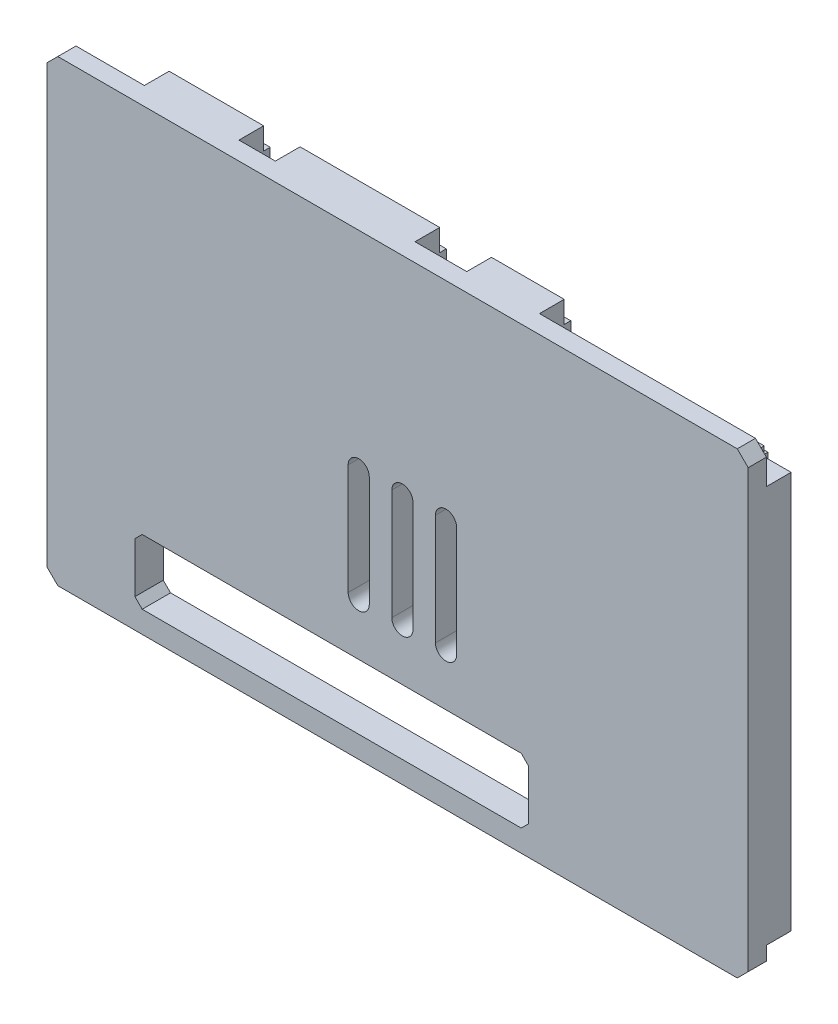
from build123d import *

# Parameters (mm, degrees)
SKETCH1_W            = 96.4
SKETCH1_H            = 63
BOSS_EXTRUDE1_DEPTH  = 2.5
SKETCH1_5_W          = 93
SKETCH1_5_H          = 59.6
BOSS_EXTRUDE2_DEPTH  = 1.4
CHAMFER1_SIZE        = 1.5
SKETCH3_W            = 1.7
SKETCH3_H            = 13.2
BOSS_EXTRUDE4_DEPTH  = 1.7
SKETCH4_W            = 13
SKETCH4_H            = 1.7
SKETCH4_W_2          = 10
SKETCH4_W_3          = 19.2
BOSS_EXTRUDE5_DEPTH  = 1.6
SKETCH4_3_W          = 13
SKETCH4_3_H          = 3
SKETCH4_3_W_2        = 10
SKETCH4_3_W_3        = 19.2
BOSS_EXTRUDE6_DEPTH  = 2
SKETCH3_5_W          = 3
SKETCH3_5_H          = 13.2
BOSS_EXTRUDE7_DEPTH  = 1
SKETCH5_W            = 1.7
SKETCH5_H            = 54.6
BOSS_EXTRUDE8_DEPTH  = 1.6
SKETCH5_3_W          = 3
SKETCH5_3_H          = 54.6
BOSS_EXTRUDE9_DEPTH  = 2
SKETCH7_W            = 54.1
SKETCH7_H            = 8.9
CUT_EXTRUDE2_DEPTH   = 12
CHAMFER2_SIZE        = 1
SKETCH11_W           = 10
SKETCH11_H           = 2
SKETCH11_W_2         = 19.2
SKETCH11_W_3         = 13
BOSS_EXTRUDE10_DEPTH = 2
SKETCH13_W           = 10
SKETCH13_H           = 2
SKETCH13_W_2         = 19.2
SKETCH13_W_3         = 13
BOSS_EXTRUDE12_DEPTH = 0.9
SKETCH14_W           = 54.1
SKETCH14_H           = 3
BOSS_EXTRUDE13_DEPTH = 2.9
SKETCH15_W           = 2
SKETCH15_H           = 54.6
BOSS_EXTRUDE14_DEPTH = 4.5
SKETCH16_W           = 3.5
SKETCH16_H           = 54.6
BOSS_EXTRUDE15_DEPTH = 0.8
CUT_EXTRUDE3_DEPTH   = 10


with BuildPart() as part:
    # Sketch1 → Boss-Extrude1 (new body)
    with BuildSketch(Plane.XY):
        with Locations((10.058192988, -1.431154761)):
            Rectangle(SKETCH1_W, SKETCH1_H)
    extrude(amount=BOSS_EXTRUDE1_DEPTH)

    # Sketch1<5> → Boss-Extrude2 (add)
    with BuildSketch(Plane.XY):
        with Locations((10.058192988, -1.431154761)):
            Rectangle(SKETCH1_5_W, SKETCH1_5_H)
    extrude(amount=-BOSS_EXTRUDE2_DEPTH)

    # Chamfer1
    chamfer1_edges = [part.edges().sort_by_distance(p)[0] for p in [
        (58.258192988, 30.068845239, 1.25),
        (-38.141807012, 30.068845239, 1.25),
        (-38.141807012, -32.931154761, 1.25),
        (58.258192988, -32.931154761, 1.25),
    ]]
    chamfer(chamfer1_edges, length=CHAMFER1_SIZE)

    # Sketch3 → Boss-Extrude4 (add)
    with BuildSketch(Plane(origin=(0, 0, -1.4), x_dir=(-1, 0, 0), z_dir=(0, 0, -1))):
        with Locations((37.291807012, -1.631154761)):
            Rectangle(SKETCH3_W, SKETCH3_H)
    extrude(amount=-BOSS_EXTRUDE4_DEPTH)

    # Sketch4 → Boss-Extrude5 (add)
    with BuildSketch(Plane(origin=(0, 0, -1.4), x_dir=(-1, 0, 0), z_dir=(0, 0, -1))):
        with Locations((20.741807012, 29.218845239)):
            Rectangle(SKETCH4_W, SKETCH4_H)
        with Locations((-22.068192988, 29.218845239)):
            Rectangle(SKETCH4_W_2, SKETCH4_H)
        with Locations((-0.358192988, 29.218845239)):
            Rectangle(SKETCH4_W_3, SKETCH4_H)
    extrude(amount=-BOSS_EXTRUDE5_DEPTH)

    # Sketch4<3> → Boss-Extrude6 (add)
    with BuildSketch(Plane(origin=(0, 0, -1.4), x_dir=(-1, 0, 0), z_dir=(0, 0, -1))):
        with Locations((20.741807012, 28.568845239)):
            Rectangle(SKETCH4_3_W, SKETCH4_3_H)
        with Locations((-22.068192988, 28.568845239)):
            Rectangle(SKETCH4_3_W_2, SKETCH4_3_H)
        with Locations((-0.358192988, 28.568845239)):
            Rectangle(SKETCH4_3_W_3, SKETCH4_3_H)
    extrude(amount=BOSS_EXTRUDE6_DEPTH)

    # Sketch3<5> → Boss-Extrude7 (add)
    with BuildSketch(Plane(origin=(0, 0, -1.4), x_dir=(-1, 0, 0), z_dir=(0, 0, -1))):
        with Locations((36.641807012, -1.631154761)):
            Rectangle(SKETCH3_5_W, SKETCH3_5_H)
    extrude(amount=BOSS_EXTRUDE7_DEPTH)

    # Sketch5 → Boss-Extrude8 (add)
    with BuildSketch(Plane(origin=(0, 0, -1.4), x_dir=(-1, 0, 0), z_dir=(0, 0, -1))):
        with Locations((-57.408192988, -2.231154761)):
            Rectangle(SKETCH5_W, SKETCH5_H)
    extrude(amount=-BOSS_EXTRUDE8_DEPTH)

    # Sketch5<3> → Boss-Extrude9 (add)
    with BuildSketch(Plane(origin=(0, 0, -1.4), x_dir=(-1, 0, 0), z_dir=(0, 0, -1))):
        with Locations((-56.758192988, -2.231154761)):
            Rectangle(SKETCH5_3_W, SKETCH5_3_H)
    extrude(amount=BOSS_EXTRUDE9_DEPTH)

    # Sketch7 → Cut-Extrude2 (cut)
    with BuildSketch(Plane.XY.offset(2.5)):
        with Locations((1.008192988, -25.481154761)):
            Rectangle(SKETCH7_W, SKETCH7_H)
    extrude(amount=-CUT_EXTRUDE2_DEPTH, mode=Mode.SUBTRACT)

    # Chamfer2
    chamfer2_edges = [part.edges().sort_by_distance(p)[0] for p in [
        (28.058192988, -21.031154761, 0.55),
        (28.058192988, -29.931154761, 0.55),
        (-26.041807012, -29.931154761, 0.55),
        (-26.041807012, -21.031154761, 0.55),
    ]]
    chamfer(chamfer2_edges, length=CHAMFER2_SIZE)

    # Sketch11 → Boss-Extrude10 (add)
    with BuildSketch(Plane.XZ.offset(-27.068845239)):
        with Locations((22.068192988, -2.4)):
            Rectangle(SKETCH11_W, SKETCH11_H)
        with Locations((0.358192988, -2.4)):
            Rectangle(SKETCH11_W_2, SKETCH11_H)
        with Locations((-20.741807012, -2.4)):
            Rectangle(SKETCH11_W_3, SKETCH11_H)
    extrude(amount=BOSS_EXTRUDE10_DEPTH)

    # Sketch13 → Boss-Extrude12 (add)
    with BuildSketch(Plane(origin=(0, 0, -3.4), x_dir=(-1, 0, 0), z_dir=(0, 0, -1))):
        with Locations((-22.068192988, 26.068845239)):
            Rectangle(SKETCH13_W, SKETCH13_H)
        with Locations((-0.358192988, 26.068845239)):
            Rectangle(SKETCH13_W_2, SKETCH13_H)
        with Locations((20.741807012, 26.068845239)):
            Rectangle(SKETCH13_W_3, SKETCH13_H)
    extrude(amount=BOSS_EXTRUDE12_DEPTH)

    # Sketch14 → Boss-Extrude13 (add)
    with BuildSketch(Plane(origin=(0, 0, -1.4), x_dir=(-1, 0, 0), z_dir=(0, 0, -1))):
        with Locations((-1.008192988, -19.531154761)):
            Rectangle(SKETCH14_W, SKETCH14_H)
    extrude(amount=BOSS_EXTRUDE13_DEPTH)

    # Sketch15 → Boss-Extrude14 (add)
    with BuildSketch(Plane.ZY.offset(-55.258192988)):
        with Locations((-2.4, -2.231154761)):
            Rectangle(SKETCH15_W, SKETCH15_H)
    extrude(amount=BOSS_EXTRUDE14_DEPTH)

    # Sketch16 → Boss-Extrude15 (add)
    with BuildSketch(Plane(origin=(0, 0, -3.4), x_dir=(-1, 0, 0), z_dir=(0, 0, -1))):
        with Locations((-52.508192988, -2.231154761)):
            Rectangle(SKETCH16_W, SKETCH16_H)
    extrude(amount=BOSS_EXTRUDE15_DEPTH)

    # Sketch17 → Cut-Extrude3 (cut)
    with BuildSketch(Plane.XY.offset(2.5)):
        with BuildLine():
            Line((6.173335738, -13.776270945), (6.173335738, 1.417718204))
            ThreePointArc((6.173335738, 1.417718204), (4.722208704, 2.868845239), (3.271081669, 1.417718204))
            Line((3.271081669, 1.417718204), (3.271081669, -13.776270945))
            ThreePointArc((3.271081669, -13.776270945), (4.722208704, -15.227397979), (6.173335738, -13.776270945))
        make_face()
        with BuildLine():
            Line((12.173335738, -13.776270945), (12.173335738, 1.417718204))
            ThreePointArc((12.173335738, 1.417718204), (10.722208704, 2.868845239), (9.271081669, 1.417718204))
            Line((9.271081669, 1.417718204), (9.271081669, -13.776270945))
            ThreePointArc((9.271081669, -13.776270945), (10.722208704, -15.227397979), (12.173335738, -13.776270945))
        make_face()
        with BuildLine():
            Line((18.173335738, -13.776270945), (18.173335738, 1.417718204))
            ThreePointArc((18.173335738, 1.417718204), (16.722208704, 2.868845239), (15.271081669, 1.417718204))
            Line((15.271081669, 1.417718204), (15.271081669, -13.776270945))
            ThreePointArc((15.271081669, -13.776270945), (16.722208704, -15.227397979), (18.173335738, -13.776270945))
        make_face()
    extrude(amount=-CUT_EXTRUDE3_DEPTH, mode=Mode.SUBTRACT)


solid = part.part
